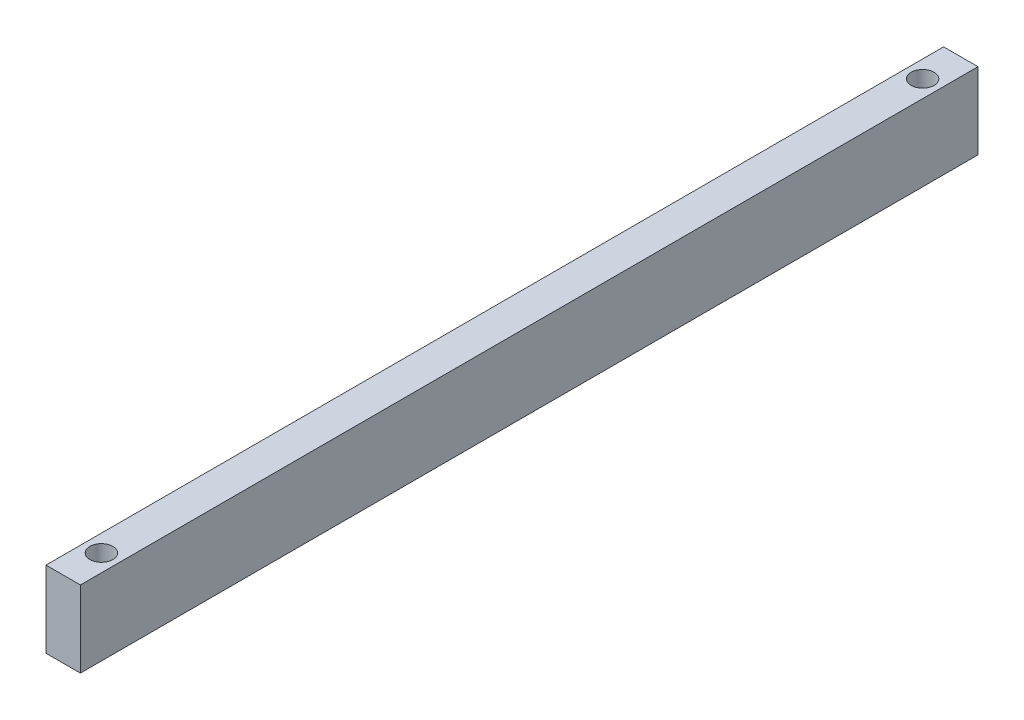
from build123d import *

# Parameters (mm, degrees)
SKETCH1_W           = 9
SKETCH1_H           = 20
BOSS_EXTRUDE1_DEPTH = 117.5
SKETCH3_R           = 3
CUT_EXTRUDE2_DEPTH  = 120.27489258


with BuildPart() as part:
    # Sketch1 → Boss-Extrude1 (new, symmetric)
    with BuildSketch(Plane.XY):
        Rectangle(SKETCH1_W, SKETCH1_H)
    extrude(amount=BOSS_EXTRUDE1_DEPTH, both=True)

    # Sketch3 → Cut-Extrude2 (cut, through all)
    with BuildSketch(Plane(origin=(0, 10, 0), x_dir=(1, 0, 0), z_dir=(0, 1, 0))):
        with Locations(Location((0, -107.5, 0), (0, 0, 270))):
            Circle(SKETCH3_R)
    cut_extrude2 = extrude(amount=-CUT_EXTRUDE2_DEPTH, mode=Mode.SUBTRACT)

    # Mirror2: Cut-Extrude2 across plane
    add(cut_extrude2.mirror(Plane.XY), mode=Mode.SUBTRACT)


solid = part.part
